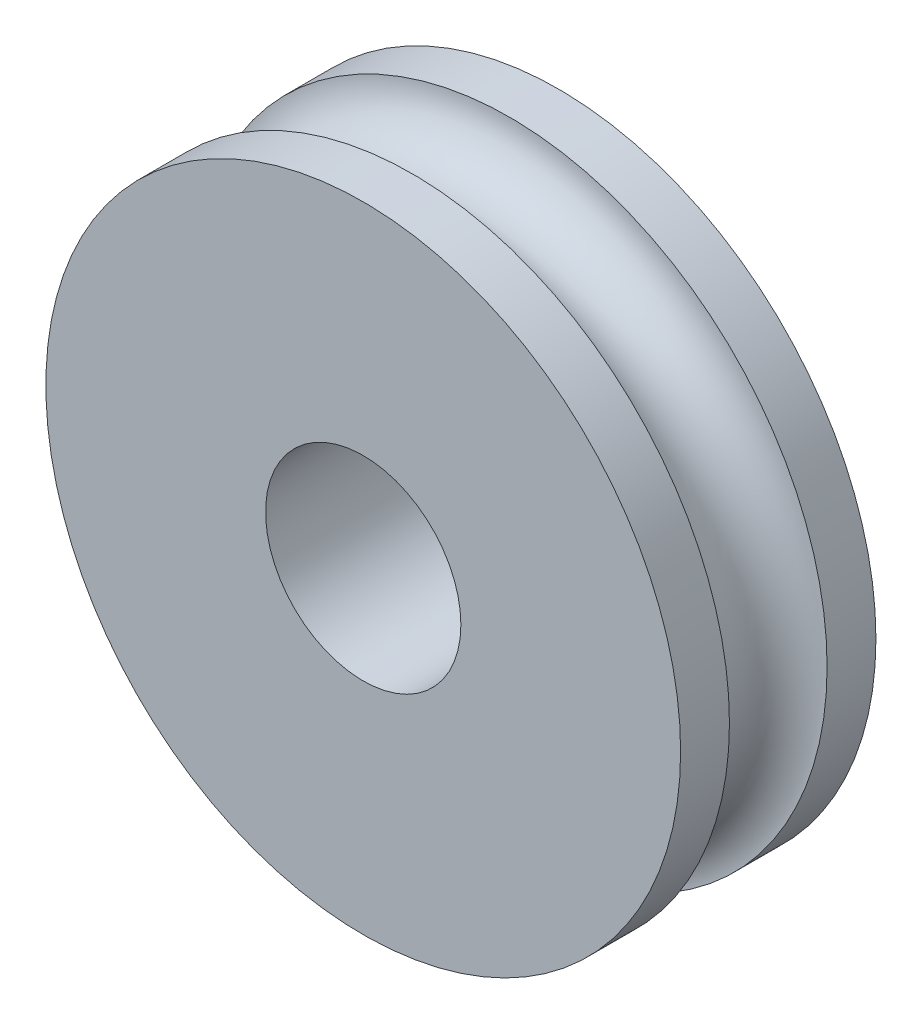
from build123d import *

# Parameters (mm, degrees)
BOSS_EXTRUDE2_DEPTH      = 2
BOSS_EXTRUDE2_DEPTH_BACK = 2
SKETCH8_R                = 6.5
CUT_SWEEP1_PROFILE_R     = 1
SKETCH26_R               = 2
CUT_EXTRUDE1_DEPTH       = 11.024968828


with BuildPart() as part:
    # Sketch8 → Boss-Extrude2 (new, two sides: drawn at the far end of the back side and taken through both)
    with BuildSketch(Plane.XY.offset(-BOSS_EXTRUDE2_DEPTH_BACK)):
        Circle(SKETCH8_R)
    extrude(amount=BOSS_EXTRUDE2_DEPTH + BOSS_EXTRUDE2_DEPTH_BACK)

    # Cut-Sweep1: sweep along a path in Sketch9
    with BuildLine(Plane.XY) as cut_sweep1_path:
        CenterArc((0, 0), 6.5, 0, 360)
    # Cut-Sweep1 profile (on start of the path) → Cut-Sweep1 (sweep, cut)
    with BuildSketch(Plane(origin=(6.5, 0, 0), x_dir=(0, 0, 1), z_dir=(0, 1, 0))):
        Circle(CUT_SWEEP1_PROFILE_R)
    sweep(path=cut_sweep1_path.line, mode=Mode.SUBTRACT)

    # Sketch26 → Cut-Extrude1 (cut, through all)
    with BuildSketch(Plane.XY.offset(2)):
        Circle(SKETCH26_R)
    extrude(amount=-CUT_EXTRUDE1_DEPTH, mode=Mode.SUBTRACT)


solid = part.part
